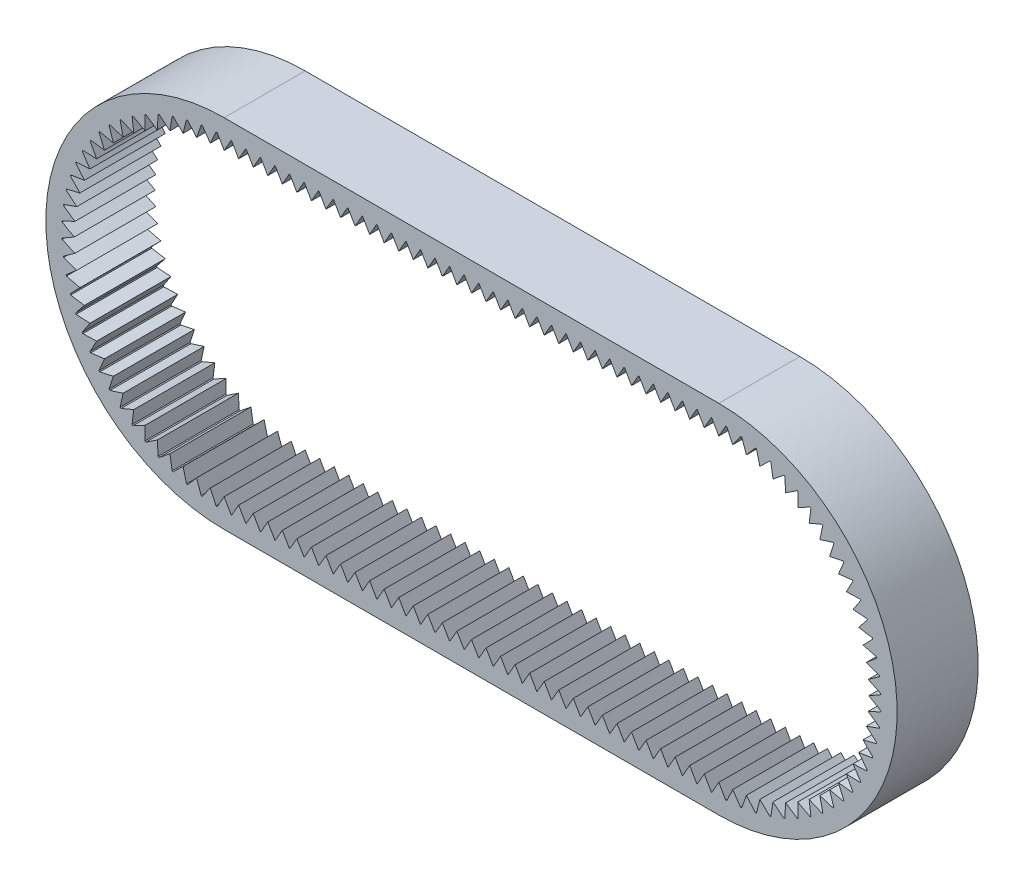
from build123d import *

# Parameters (mm, degrees)
BOSS_EXTRUDE1_DEPTH = 5


with BuildPart() as part:
    # Sketch1 → Boss-Extrude1 (new body)
    with BuildSketch(Plane.XY):
        with BuildLine():
            Line((0, 11), (30.518298, 11))
            ThreePointArc((30.518298, 11), (41.518298, 0), (30.518298, -11))
            Line((30.518298, -11), (0, -11))
            ThreePointArc((0, -11), (-11, 0), (0, 11))
        make_face()
        with BuildLine():
            Line((0.433012702, 10), (0.464584298, 10))
            Line((0.464584298, 10), (0.897597, 9.25))
            Line((0.897597, 9.25), (1.330609702, 10))
            Line((1.330609702, 10), (1.362181298, 10))
            Line((1.362181298, 10), (1.795194, 9.25))
            Line((1.795194, 9.25), (2.228206702, 10))
            Line((2.228206702, 10), (2.259778298, 10))
            Line((2.259778298, 10), (2.692791, 9.25))
            Line((2.692791, 9.25), (3.125803702, 10))
            Line((3.125803702, 10), (3.157375298, 10))
            Line((3.157375298, 10), (3.590388, 9.25))
            Line((3.590388, 9.25), (4.023400702, 10))
            Line((4.023400702, 10), (4.054972298, 10))
            Line((4.054972298, 10), (4.487985, 9.25))
            Line((4.487985, 9.25), (4.920997702, 10))
            Line((4.920997702, 10), (4.952569298, 10))
            Line((4.952569298, 10), (5.385582, 9.25))
            Line((5.385582, 9.25), (5.818594702, 10))
            Line((5.818594702, 10), (5.850166298, 10))
            Line((5.850166298, 10), (6.283179, 9.25))
            Line((6.283179, 9.25), (6.716191702, 10))
            Line((6.716191702, 10), (6.747763298, 10))
            Line((6.747763298, 10), (7.180776, 9.25))
            Line((7.180776, 9.25), (7.613788702, 10))
            Line((7.613788702, 10), (7.645360298, 10))
            Line((7.645360298, 10), (8.078373, 9.25))
            Line((8.078373, 9.25), (8.511385702, 10))
            Line((8.511385702, 10), (8.542957298, 10))
            Line((8.542957298, 10), (8.97597, 9.25))
            Line((8.97597, 9.25), (9.408982702, 10))
            Line((9.408982702, 10), (9.440554298, 10))
            Line((9.440554298, 10), (9.873567, 9.25))
            Line((9.873567, 9.25), (10.306579702, 10))
            Line((10.306579702, 10), (10.338151298, 10))
            Line((10.338151298, 10), (10.771164, 9.25))
            Line((10.771164, 9.25), (11.204176702, 10))
            Line((11.204176702, 10), (11.235748298, 10))
            Line((11.235748298, 10), (11.668761, 9.25))
            Line((11.668761, 9.25), (12.101773702, 10))
            Line((12.101773702, 10), (12.133345298, 10))
            Line((12.133345298, 10), (12.566358, 9.25))
            Line((12.566358, 9.25), (12.999370702, 10))
            Line((12.999370702, 10), (13.030942298, 10))
            Line((13.030942298, 10), (13.463955, 9.25))
            Line((13.463955, 9.25), (13.896967702, 10))
            Line((13.896967702, 10), (13.928539298, 10))
            Line((13.928539298, 10), (14.361552, 9.25))
            Line((14.361552, 9.25), (14.794564702, 10))
            Line((14.794564702, 10), (14.826136298, 10))
            Line((14.826136298, 10), (15.259149, 9.25))
            Line((15.259149, 9.25), (15.692161702, 10))
            Line((15.692161702, 10), (15.723733298, 10))
            Line((15.723733298, 10), (16.156746, 9.25))
            Line((16.156746, 9.25), (16.589758702, 10))
            Line((16.589758702, 10), (16.621330298, 10))
            Line((16.621330298, 10), (17.054343, 9.25))
            Line((17.054343, 9.25), (17.487355702, 10))
            Line((17.487355702, 10), (17.518927298, 10))
            Line((17.518927298, 10), (17.95194, 9.25))
            Line((17.95194, 9.25), (18.384952702, 10))
            Line((18.384952702, 10), (18.416524298, 10))
            Line((18.416524298, 10), (18.849537, 9.25))
            Line((18.849537, 9.25), (19.282549702, 10))
            Line((19.282549702, 10), (19.314121298, 10))
            Line((19.314121298, 10), (19.747134, 9.25))
            Line((19.747134, 9.25), (20.180146702, 10))
            Line((20.180146702, 10), (20.211718298, 10))
            Line((20.211718298, 10), (20.644731, 9.25))
            Line((20.644731, 9.25), (21.077743702, 10))
            Line((21.077743702, 10), (21.109315298, 10))
            Line((21.109315298, 10), (21.542328, 9.25))
            Line((21.542328, 9.25), (21.975340702, 10))
            Line((21.975340702, 10), (22.006912298, 10))
            Line((22.006912298, 10), (22.439925, 9.25))
            Line((22.439925, 9.25), (22.872937702, 10))
            Line((22.872937702, 10), (22.904509298, 10))
            Line((22.904509298, 10), (23.337522, 9.25))
            Line((23.337522, 9.25), (23.770534702, 10))
            Line((23.770534702, 10), (23.802106298, 10))
            Line((23.802106298, 10), (24.235119, 9.25))
            Line((24.235119, 9.25), (24.668131702, 10))
            Line((24.668131702, 10), (24.699703298, 10))
            Line((24.699703298, 10), (25.132716, 9.25))
            Line((25.132716, 9.25), (25.565728702, 10))
            Line((25.565728702, 10), (25.597300298, 10))
            Line((25.597300298, 10), (26.030313, 9.25))
            Line((26.030313, 9.25), (26.463325702, 10))
            Line((26.463325702, 10), (26.494897298, 10))
            Line((26.494897298, 10), (26.92791, 9.25))
            Line((26.92791, 9.25), (27.360922702, 10))
            Line((27.360922702, 10), (27.392494298, 10))
            Line((27.392494298, 10), (27.825507, 9.25))
            Line((27.825507, 9.25), (28.258519702, 10))
            Line((28.258519702, 10), (28.290091298, 10))
            Line((28.290091298, 10), (28.723104, 9.25))
            Line((28.723104, 9.25), (29.156116702, 10))
            Line((29.156116702, 10), (29.187688298, 10))
            Line((29.187688298, 10), (29.620701, 9.25))
            Line((29.620701, 9.25), (30.053713702, 10))
            Line((30.053713702, 10), (30.085285298, 10))
            Line((30.085285298, 10), (30.518298, 9.25))
            Line((30.518298, 9.25), (30.946026914, 9.990848211))
            ThreePointArc((30.946026914, 9.990848211), (30.980132586, 9.989329748), (31.014232876, 9.987694859))
            Line((31.014232876, 9.987694859), (31.371780325, 9.210541131))
            Line((31.371780325, 9.210541131), (31.866041472, 9.908763169))
            ThreePointArc((31.866041472, 9.908763169), (31.89986155, 9.904104309), (31.933665525, 9.899330016))
            Line((31.933665525, 9.899330016), (32.21798104, 9.092501172))
            Line((32.21798104, 9.092501172), (32.774557558, 9.742140053))
            ThreePointArc((32.774557558, 9.742140053), (32.8078035, 9.734380544), (32.841022757, 9.72650758))
            Line((32.841022757, 9.72650758), (33.049680658, 8.896887199))
            Line((33.049680658, 8.896887199), (33.663824033, 9.492400433))
            ThreePointArc((33.663824033, 9.492400433), (33.696212196, 9.481606476), (33.72856332, 9.470702011))
            Line((33.72856332, 9.470702011), (33.859783412, 8.625368122))
            Line((33.859783412, 8.625368122), (34.526253988, 9.161674999))
            ThreePointArc((34.526253988, 9.161674999), (34.557508049, 9.147938685), (34.588715032, 9.134095751))
            Line((34.588715032, 9.134095751), (34.641377791, 8.280260445))
            Line((34.641377791, 8.280260445), (35.354489477, 8.752785385))
            ThreePointArc((35.354489477, 8.752785385), (35.384342786, 8.736223906), (35.414139381, 8.719560607))
            Line((35.414139381, 8.719560607), (35.387795507, 7.864508505))
            Line((35.387795507, 7.864508505), (36.141464285, 8.269220092))
            ThreePointArc((36.141464285, 8.269220092), (36.169662144, 8.249974746), (36.197794137, 8.230633246))
            Line((36.197794137, 8.230633246), (36.092668387, 7.381659352))
            Line((36.092668387, 7.381659352), (36.880464221, 7.715104729))
            ThreePointArc((36.880464221, 7.715104729), (36.906766057, 7.69333971), (36.932993434, 7.671485025))
            Line((36.932993434, 7.671485025), (36.749982704, 6.835832484))
            Line((36.749982704, 6.835832484), (37.565184398, 7.095166812))
            ThreePointArc((37.565184398, 7.095166812), (37.589365812, 7.071067812), (37.613464812, 7.046886398))
            Line((37.613464812, 7.046886398), (37.354130484, 6.231684704))
            Line((37.354130484, 6.231684704), (38.189783025, 6.414695434))
            ThreePointArc((38.189783025, 6.414695434), (38.21163771, 6.388468057), (38.233402729, 6.362166221))
            Line((38.233402729, 6.362166221), (37.899957352, 5.574370387))
            Line((37.899957352, 5.574370387), (38.748931246, 5.679496137))
            ThreePointArc((38.748931246, 5.679496137), (38.768272746, 5.651364144), (38.787518092, 5.623166285))
            Line((38.787518092, 5.623166285), (38.382806505, 4.869497507))
            Line((38.382806505, 4.869497507), (39.237858607, 4.895841381))
            ThreePointArc((39.237858607, 4.895841381), (39.254521906, 4.866044786), (39.271083385, 4.836191477))
            Line((39.271083385, 4.836191477), (38.798558445, 4.123079791))
            Line((38.798558445, 4.123079791), (39.652393751, 4.070417032))
            ThreePointArc((39.652393751, 4.070417032), (39.666236685, 4.039210049), (39.679972999, 4.007955988))
            Line((39.679972999, 4.007955988), (39.143666122, 3.341485412))
            Line((39.143666122, 3.341485412), (39.989000011, 3.21026532))
            ThreePointArc((39.989000011, 3.21026532), (39.999904476, 3.177914196), (40.010698433, 3.145526033))
            Line((40.010698433, 3.145526033), (39.415185199, 2.531382658))
            Line((39.415185199, 2.531382658), (40.24480558, 2.322724757))
            ThreePointArc((40.24480558, 2.322724757), (40.252678544, 2.2895055), (40.260438053, 2.256259558))
            Line((40.260438053, 2.256259558), (39.610799172, 1.69968304))
            Line((39.610799172, 1.69968304), (40.417628016, 1.415367525))
            ThreePointArc((40.417628016, 1.415367525), (40.422402309, 1.38156355), (40.427061169, 1.347743472))
            Line((40.427061169, 1.347743472), (39.728839131, 0.853482325))
            Line((39.728839131, 0.853482325), (40.505992859, 0.495934876))
            ThreePointArc((40.505992859, 0.495934876), (40.507627748, 0.461834586), (40.509146211, 0.427728914))
            Line((40.509146211, 0.427728914), (39.768298, 0))
            Line((39.768298, 0), (40.509146211, -0.427728914))
            ThreePointArc((40.509146211, -0.427728914), (40.507627748, -0.461834586), (40.505992859, -0.495934876))
            Line((40.505992859, -0.495934876), (39.728839131, -0.853482325))
            Line((39.728839131, -0.853482325), (40.427061169, -1.347743472))
            ThreePointArc((40.427061169, -1.347743472), (40.422402309, -1.38156355), (40.417628016, -1.415367525))
            Line((40.417628016, -1.415367525), (39.610799172, -1.69968304))
            Line((39.610799172, -1.69968304), (40.260438053, -2.256259558))
            ThreePointArc((40.260438053, -2.256259558), (40.252678544, -2.289505499), (40.24480558, -2.322724757))
            Line((40.24480558, -2.322724757), (39.415185199, -2.531382658))
            Line((39.415185199, -2.531382658), (40.010698433, -3.145526033))
            ThreePointArc((40.010698433, -3.145526033), (39.999904476, -3.177914196), (39.989000011, -3.21026532))
            Line((39.989000011, -3.21026532), (39.143666122, -3.341485412))
            Line((39.143666122, -3.341485412), (39.679972999, -4.007955988))
            ThreePointArc((39.679972999, -4.007955988), (39.666236685, -4.039210049), (39.652393751, -4.070417032))
            Line((39.652393751, -4.070417032), (38.798558445, -4.123079791))
            Line((38.798558445, -4.123079791), (39.271083385, -4.836191477))
            ThreePointArc((39.271083385, -4.836191477), (39.254521906, -4.866044786), (39.237858607, -4.895841381))
            Line((39.237858607, -4.895841381), (38.382806506, -4.869497507))
            Line((38.382806506, -4.869497507), (38.787518092, -5.623166285))
            ThreePointArc((38.787518092, -5.623166285), (38.768272746, -5.651364144), (38.748931246, -5.679496137))
            Line((38.748931246, -5.679496137), (37.899957352, -5.574370387))
            Line((37.899957352, -5.574370387), (38.233402729, -6.362166221))
            ThreePointArc((38.233402729, -6.362166221), (38.21163771, -6.388468057), (38.189783025, -6.414695434))
            Line((38.189783025, -6.414695434), (37.354130484, -6.231684704))
            Line((37.354130484, -6.231684704), (37.613464812, -7.046886398))
            ThreePointArc((37.613464812, -7.046886398), (37.589365812, -7.071067812), (37.565184398, -7.095166812))
            Line((37.565184398, -7.095166812), (36.749982704, -6.835832484))
            Line((36.749982704, -6.835832484), (36.932993434, -7.671485025))
            ThreePointArc((36.932993434, -7.671485025), (36.906766057, -7.69333971), (36.880464221, -7.715104729))
            Line((36.880464221, -7.715104729), (36.092668387, -7.381659352))
            Line((36.092668387, -7.381659352), (36.197794137, -8.230633246))
            ThreePointArc((36.197794137, -8.230633246), (36.169662144, -8.249974746), (36.141464285, -8.269220092))
            Line((36.141464285, -8.269220092), (35.387795507, -7.864508505))
            Line((35.387795507, -7.864508505), (35.414139381, -8.719560607))
            ThreePointArc((35.414139381, -8.719560607), (35.384342786, -8.736223906), (35.354489477, -8.752785385))
            Line((35.354489477, -8.752785385), (34.641377791, -8.280260445))
            Line((34.641377791, -8.280260445), (34.588715032, -9.134095751))
            ThreePointArc((34.588715032, -9.134095751), (34.557508049, -9.147938685), (34.526253988, -9.161674999))
            Line((34.526253988, -9.161674999), (33.859783412, -8.625368122))
            Line((33.859783412, -8.625368122), (33.72856332, -9.470702011))
            ThreePointArc((33.72856332, -9.470702011), (33.696212196, -9.481606476), (33.663824033, -9.492400433))
            Line((33.663824033, -9.492400433), (33.049680658, -8.896887199))
            Line((33.049680658, -8.896887199), (32.841022757, -9.72650758))
            ThreePointArc((32.841022757, -9.72650758), (32.8078035, -9.734380544), (32.774557558, -9.742140053))
            Line((32.774557558, -9.742140053), (32.21798104, -9.092501172))
            Line((32.21798104, -9.092501172), (31.933665525, -9.899330016))
            ThreePointArc((31.933665525, -9.899330016), (31.89986155, -9.904104309), (31.866041472, -9.908763169))
            Line((31.866041472, -9.908763169), (31.371780325, -9.210541131))
            Line((31.371780325, -9.210541131), (31.014232876, -9.987694859))
            ThreePointArc((31.014232876, -9.987694859), (30.980132586, -9.989329748), (30.946026914, -9.990848211))
            Line((30.946026914, -9.990848211), (30.518298, -9.25))
            Line((30.518298, -9.25), (30.085285298, -10))
            Line((30.085285298, -10), (30.053713702, -10))
            Line((30.053713702, -10), (29.620701, -9.25))
            Line((29.620701, -9.25), (29.187688298, -10))
            Line((29.187688298, -10), (29.156116702, -10))
            Line((29.156116702, -10), (28.723104, -9.25))
            Line((28.723104, -9.25), (28.290091298, -10))
            Line((28.290091298, -10), (28.258519702, -10))
            Line((28.258519702, -10), (27.825507, -9.25))
            Line((27.825507, -9.25), (27.392494298, -10))
            Line((27.392494298, -10), (27.360922702, -10))
            Line((27.360922702, -10), (26.92791, -9.25))
            Line((26.92791, -9.25), (26.494897298, -10))
            Line((26.494897298, -10), (26.463325702, -10))
            Line((26.463325702, -10), (26.030313, -9.25))
            Line((26.030313, -9.25), (25.597300298, -10))
            Line((25.597300298, -10), (25.565728702, -10))
            Line((25.565728702, -10), (25.132716, -9.25))
            Line((25.132716, -9.25), (24.699703298, -10))
            Line((24.699703298, -10), (24.668131702, -10))
            Line((24.668131702, -10), (24.235119, -9.25))
            Line((24.235119, -9.25), (23.802106298, -10))
            Line((23.802106298, -10), (23.770534702, -10))
            Line((23.770534702, -10), (23.337522, -9.25))
            Line((23.337522, -9.25), (22.904509298, -10))
            Line((22.904509298, -10), (22.872937702, -10))
            Line((22.872937702, -10), (22.439925, -9.25))
            Line((22.439925, -9.25), (22.006912298, -10))
            Line((22.006912298, -10), (21.975340702, -10))
            Line((21.975340702, -10), (21.542328, -9.25))
            Line((21.542328, -9.25), (21.109315298, -10))
            Line((21.109315298, -10), (21.077743702, -10))
            Line((21.077743702, -10), (20.644731, -9.25))
            Line((20.644731, -9.25), (20.211718298, -10))
            Line((20.211718298, -10), (20.180146702, -10))
            Line((20.180146702, -10), (19.747134, -9.25))
            Line((19.747134, -9.25), (19.314121298, -10))
            Line((19.314121298, -10), (19.282549702, -10))
            Line((19.282549702, -10), (18.849537, -9.25))
            Line((18.849537, -9.25), (18.416524298, -10))
            Line((18.416524298, -10), (18.384952702, -10))
            Line((18.384952702, -10), (17.95194, -9.25))
            Line((17.95194, -9.25), (17.518927298, -10))
            Line((17.518927298, -10), (17.487355702, -10))
            Line((17.487355702, -10), (17.054343, -9.25))
            Line((17.054343, -9.25), (16.621330298, -10))
            Line((16.621330298, -10), (16.589758702, -10))
            Line((16.589758702, -10), (16.156746, -9.25))
            Line((16.156746, -9.25), (15.723733298, -10))
            Line((15.723733298, -10), (15.692161702, -10))
            Line((15.692161702, -10), (15.259149, -9.25))
            Line((15.259149, -9.25), (14.826136298, -10))
            Line((14.826136298, -10), (14.794564702, -10))
            Line((14.794564702, -10), (14.361552, -9.25))
            Line((14.361552, -9.25), (13.928539298, -10))
            Line((13.928539298, -10), (13.896967702, -10))
            Line((13.896967702, -10), (13.463955, -9.25))
            Line((13.463955, -9.25), (13.030942298, -10))
            Line((13.030942298, -10), (12.999370702, -10))
            Line((12.999370702, -10), (12.566358, -9.25))
            Line((12.566358, -9.25), (12.133345298, -10))
            Line((12.133345298, -10), (12.101773702, -10))
            Line((12.101773702, -10), (11.668761, -9.25))
            Line((11.668761, -9.25), (11.235748298, -10))
            Line((11.235748298, -10), (11.204176702, -10))
            Line((11.204176702, -10), (10.771164, -9.25))
            Line((10.771164, -9.25), (10.338151298, -10))
            Line((10.338151298, -10), (10.306579702, -10))
            Line((10.306579702, -10), (9.873567, -9.25))
            Line((9.873567, -9.25), (9.440554298, -10))
            Line((9.440554298, -10), (9.408982702, -10))
            Line((9.408982702, -10), (8.97597, -9.25))
            Line((8.97597, -9.25), (8.542957298, -10))
            Line((8.542957298, -10), (8.511385702, -10))
            Line((8.511385702, -10), (8.078373, -9.25))
            Line((8.078373, -9.25), (7.645360298, -10))
            Line((7.645360298, -10), (7.613788702, -10))
            Line((7.613788702, -10), (7.180776, -9.25))
            Line((7.180776, -9.25), (6.747763298, -10))
            Line((6.747763298, -10), (6.716191702, -10))
            Line((6.716191702, -10), (6.283179, -9.25))
            Line((6.283179, -9.25), (5.850166298, -10))
            Line((5.850166298, -10), (5.818594702, -10))
            Line((5.818594702, -10), (5.385582, -9.25))
            Line((5.385582, -9.25), (4.952569298, -10))
            Line((4.952569298, -10), (4.920997702, -10))
            Line((4.920997702, -10), (4.487985, -9.25))
            Line((4.487985, -9.25), (4.054972298, -10))
            Line((4.054972298, -10), (4.023400702, -10))
            Line((4.023400702, -10), (3.590388, -9.25))
            Line((3.590388, -9.25), (3.157375298, -10))
            Line((3.157375298, -10), (3.125803702, -10))
            Line((3.125803702, -10), (2.692791, -9.25))
            Line((2.692791, -9.25), (2.259778298, -10))
            Line((2.259778298, -10), (2.228206702, -10))
            Line((2.228206702, -10), (1.795194, -9.25))
            Line((1.795194, -9.25), (1.362181298, -10))
            Line((1.362181298, -10), (1.330609702, -10))
            Line((1.330609702, -10), (0.897597, -9.25))
            Line((0.897597, -9.25), (0.464584298, -10))
            Line((0.464584298, -10), (0.433012702, -10))
            Line((0.433012702, -10), (0, -9.25))
            Line((0, -9.25), (-0.427728914, -9.990848211))
            ThreePointArc((-0.427728914, -9.990848211), (-0.461834586, -9.989329748), (-0.495934876, -9.987694859))
            Line((-0.495934876, -9.987694859), (-0.853482325, -9.210541131))
            Line((-0.853482325, -9.210541131), (-1.347743472, -9.908763169))
            ThreePointArc((-1.347743472, -9.908763169), (-1.38156355, -9.904104309), (-1.415367525, -9.899330016))
            Line((-1.415367525, -9.899330016), (-1.69968304, -9.092501172))
            Line((-1.69968304, -9.092501172), (-2.256259558, -9.742140053))
            ThreePointArc((-2.256259558, -9.742140053), (-2.2895055, -9.734380544), (-2.322724757, -9.72650758))
            Line((-2.322724757, -9.72650758), (-2.531382658, -8.896887199))
            Line((-2.531382658, -8.896887199), (-3.145526033, -9.492400433))
            ThreePointArc((-3.145526033, -9.492400433), (-3.177914196, -9.481606476), (-3.21026532, -9.470702011))
            Line((-3.21026532, -9.470702011), (-3.341485412, -8.625368122))
            Line((-3.341485412, -8.625368122), (-4.007955988, -9.161674999))
            ThreePointArc((-4.007955988, -9.161674999), (-4.039210049, -9.147938685), (-4.070417032, -9.134095751))
            Line((-4.070417032, -9.134095751), (-4.123079791, -8.280260445))
            Line((-4.123079791, -8.280260445), (-4.836191477, -8.752785385))
            ThreePointArc((-4.836191477, -8.752785385), (-4.866044786, -8.736223906), (-4.895841381, -8.719560607))
            Line((-4.895841381, -8.719560607), (-4.869497507, -7.864508505))
            Line((-4.869497507, -7.864508505), (-5.623166285, -8.269220092))
            ThreePointArc((-5.623166285, -8.269220092), (-5.651364144, -8.249974746), (-5.679496137, -8.230633246))
            Line((-5.679496137, -8.230633246), (-5.574370387, -7.381659352))
            Line((-5.574370387, -7.381659352), (-6.362166221, -7.715104729))
            ThreePointArc((-6.362166221, -7.715104729), (-6.388468057, -7.69333971), (-6.414695434, -7.671485025))
            Line((-6.414695434, -7.671485025), (-6.231684704, -6.835832484))
            Line((-6.231684704, -6.835832484), (-7.046886398, -7.095166812))
            ThreePointArc((-7.046886398, -7.095166812), (-7.071067812, -7.071067812), (-7.095166812, -7.046886398))
            Line((-7.095166812, -7.046886398), (-6.835832484, -6.231684704))
            Line((-6.835832484, -6.231684704), (-7.671485025, -6.414695434))
            ThreePointArc((-7.671485025, -6.414695434), (-7.69333971, -6.388468057), (-7.715104729, -6.362166221))
            Line((-7.715104729, -6.362166221), (-7.381659352, -5.574370387))
            Line((-7.381659352, -5.574370387), (-8.230633246, -5.679496137))
            ThreePointArc((-8.230633246, -5.679496137), (-8.249974746, -5.651364144), (-8.269220092, -5.623166285))
            Line((-8.269220092, -5.623166285), (-7.864508505, -4.869497507))
            Line((-7.864508505, -4.869497507), (-8.719560607, -4.895841381))
            ThreePointArc((-8.719560607, -4.895841381), (-8.736223906, -4.866044786), (-8.752785385, -4.836191477))
            Line((-8.752785385, -4.836191477), (-8.280260445, -4.123079791))
            Line((-8.280260445, -4.123079791), (-9.134095751, -4.070417032))
            ThreePointArc((-9.134095751, -4.070417032), (-9.147938685, -4.039210049), (-9.161674999, -4.007955988))
            Line((-9.161674999, -4.007955988), (-8.625368122, -3.341485412))
            Line((-8.625368122, -3.341485412), (-9.470702011, -3.21026532))
            ThreePointArc((-9.470702011, -3.21026532), (-9.481606476, -3.177914196), (-9.492400433, -3.145526033))
            Line((-9.492400433, -3.145526033), (-8.896887199, -2.531382658))
            Line((-8.896887199, -2.531382658), (-9.72650758, -2.322724757))
            ThreePointArc((-9.72650758, -2.322724757), (-9.734380544, -2.289505499), (-9.742140053, -2.256259558))
            Line((-9.742140053, -2.256259558), (-9.092501172, -1.69968304))
            Line((-9.092501172, -1.69968304), (-9.899330016, -1.415367525))
            ThreePointArc((-9.899330016, -1.415367525), (-9.904104309, -1.38156355), (-9.908763169, -1.347743472))
            Line((-9.908763169, -1.347743472), (-9.210541131, -0.853482325))
            Line((-9.210541131, -0.853482325), (-9.987694859, -0.495934876))
            ThreePointArc((-9.987694859, -0.495934876), (-9.989329748, -0.461834586), (-9.990848211, -0.427728914))
            Line((-9.990848211, -0.427728914), (-9.25, 0))
            Line((-9.25, 0), (-9.990848211, 0.427728914))
            ThreePointArc((-9.990848211, 0.427728914), (-9.989329748, 0.461834586), (-9.987694859, 0.495934876))
            Line((-9.987694859, 0.495934876), (-9.210541131, 0.853482325))
            Line((-9.210541131, 0.853482325), (-9.908763169, 1.347743472))
            ThreePointArc((-9.908763169, 1.347743472), (-9.904104309, 1.38156355), (-9.899330016, 1.415367525))
            Line((-9.899330016, 1.415367525), (-9.092501172, 1.69968304))
            Line((-9.092501172, 1.69968304), (-9.742140053, 2.256259558))
            ThreePointArc((-9.742140053, 2.256259558), (-9.734380544, 2.2895055), (-9.72650758, 2.322724757))
            Line((-9.72650758, 2.322724757), (-8.896887199, 2.531382658))
            Line((-8.896887199, 2.531382658), (-9.492400433, 3.145526033))
            ThreePointArc((-9.492400433, 3.145526033), (-9.481606476, 3.177914196), (-9.470702011, 3.21026532))
            Line((-9.470702011, 3.21026532), (-8.625368122, 3.341485412))
            Line((-8.625368122, 3.341485412), (-9.161674999, 4.007955988))
            ThreePointArc((-9.161674999, 4.007955988), (-9.147938685, 4.039210049), (-9.134095751, 4.070417032))
            Line((-9.134095751, 4.070417032), (-8.280260445, 4.123079791))
            Line((-8.280260445, 4.123079791), (-8.752785385, 4.836191477))
            ThreePointArc((-8.752785385, 4.836191477), (-8.736223906, 4.866044786), (-8.719560607, 4.895841381))
            Line((-8.719560607, 4.895841381), (-7.864508505, 4.869497507))
            Line((-7.864508505, 4.869497507), (-8.269220092, 5.623166285))
            ThreePointArc((-8.269220092, 5.623166285), (-8.249974746, 5.651364144), (-8.230633246, 5.679496137))
            Line((-8.230633246, 5.679496137), (-7.381659352, 5.574370387))
            Line((-7.381659352, 5.574370387), (-7.715104729, 6.362166221))
            ThreePointArc((-7.715104729, 6.362166221), (-7.69333971, 6.388468057), (-7.671485025, 6.414695434))
            Line((-7.671485025, 6.414695434), (-6.835832484, 6.231684704))
            Line((-6.835832484, 6.231684704), (-7.095166812, 7.046886398))
            ThreePointArc((-7.095166812, 7.046886398), (-7.071067812, 7.071067812), (-7.046886398, 7.095166812))
            Line((-7.046886398, 7.095166812), (-6.231684704, 6.835832484))
            Line((-6.231684704, 6.835832484), (-6.414695434, 7.671485025))
            ThreePointArc((-6.414695434, 7.671485025), (-6.388468057, 7.69333971), (-6.362166221, 7.715104729))
            Line((-6.362166221, 7.715104729), (-5.574370387, 7.381659352))
            Line((-5.574370387, 7.381659352), (-5.679496137, 8.230633246))
            ThreePointArc((-5.679496137, 8.230633246), (-5.651364144, 8.249974746), (-5.623166285, 8.269220092))
            Line((-5.623166285, 8.269220092), (-4.869497507, 7.864508506))
            Line((-4.869497507, 7.864508506), (-4.895841381, 8.719560607))
            ThreePointArc((-4.895841381, 8.719560607), (-4.866044786, 8.736223906), (-4.836191477, 8.752785385))
            Line((-4.836191477, 8.752785385), (-4.123079791, 8.280260445))
            Line((-4.123079791, 8.280260445), (-4.070417032, 9.134095751))
            ThreePointArc((-4.070417032, 9.134095751), (-4.039210049, 9.147938685), (-4.007955988, 9.161674999))
            Line((-4.007955988, 9.161674999), (-3.341485412, 8.625368122))
            Line((-3.341485412, 8.625368122), (-3.21026532, 9.470702011))
            ThreePointArc((-3.21026532, 9.470702011), (-3.177914196, 9.481606476), (-3.145526033, 9.492400433))
            Line((-3.145526033, 9.492400433), (-2.531382658, 8.896887199))
            Line((-2.531382658, 8.896887199), (-2.322724757, 9.72650758))
            ThreePointArc((-2.322724757, 9.72650758), (-2.2895055, 9.734380544), (-2.256259558, 9.742140053))
            Line((-2.256259558, 9.742140053), (-1.69968304, 9.092501172))
            Line((-1.69968304, 9.092501172), (-1.415367525, 9.899330016))
            ThreePointArc((-1.415367525, 9.899330016), (-1.38156355, 9.904104309), (-1.347743472, 9.908763169))
            Line((-1.347743472, 9.908763169), (-0.853482325, 9.210541131))
            Line((-0.853482325, 9.210541131), (-0.495934876, 9.987694859))
            ThreePointArc((-0.495934876, 9.987694859), (-0.461834586, 9.989329748), (-0.427728914, 9.990848211))
            Line((-0.427728914, 9.990848211), (0, 9.25))
            Line((0, 9.25), (0.433012702, 10))
        make_face(mode=Mode.SUBTRACT)
    extrude(amount=BOSS_EXTRUDE1_DEPTH)


solid = part.part
